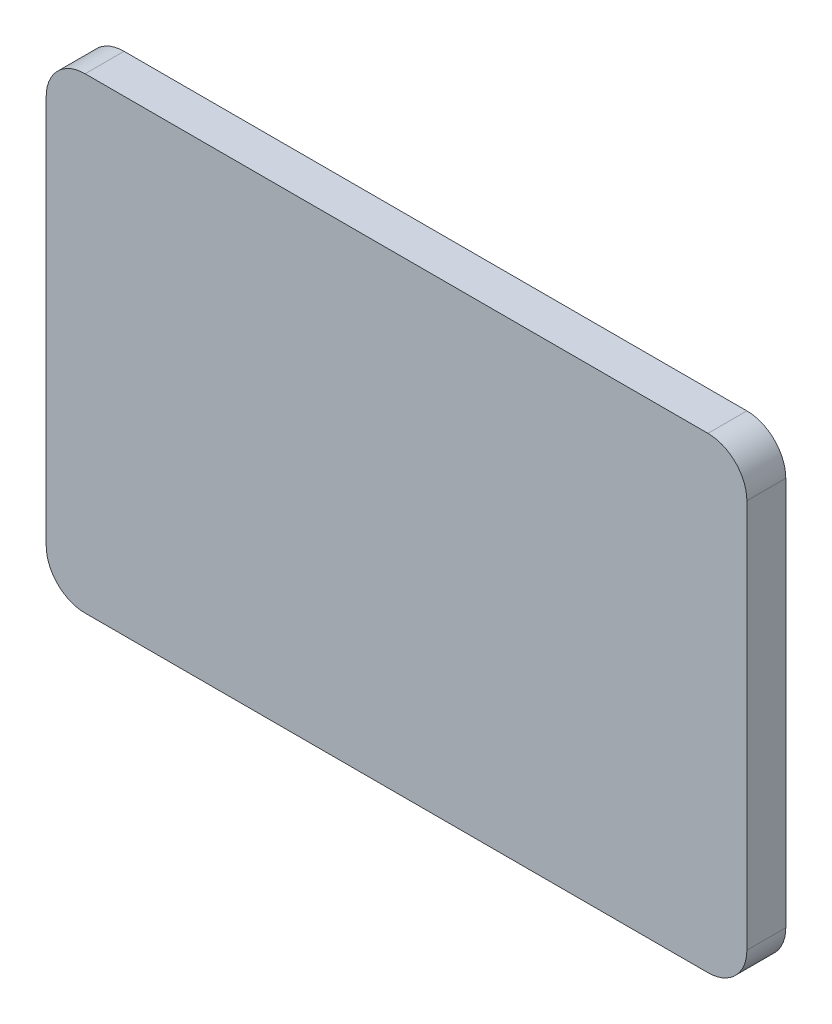
from build123d import *

# Parameters (mm, degrees)
ESTRUSIONE1_DEPTH = 10


with BuildPart() as part:
    # Schizzo1 → Estrusione1 (new body)
    with BuildSketch(Plane.XY):
        with BuildLine():
            Line((80, -60), (-80, -60))
            ThreePointArc((-80, -60), (-87.071067812, -57.071067812), (-90, -50))
            Line((-90, -50), (-90, 50))
            ThreePointArc((-90, 50), (-87.071067812, 57.071067812), (-80, 60))
            Line((-80, 60), (80, 60))
            ThreePointArc((80, 60), (87.071067812, 57.071067812), (90, 50))
            Line((90, 50), (90, -50))
            ThreePointArc((90, -50), (87.071067812, -57.071067812), (80, -60))
        make_face()
    extrude(amount=ESTRUSIONE1_DEPTH)


solid = part.part
